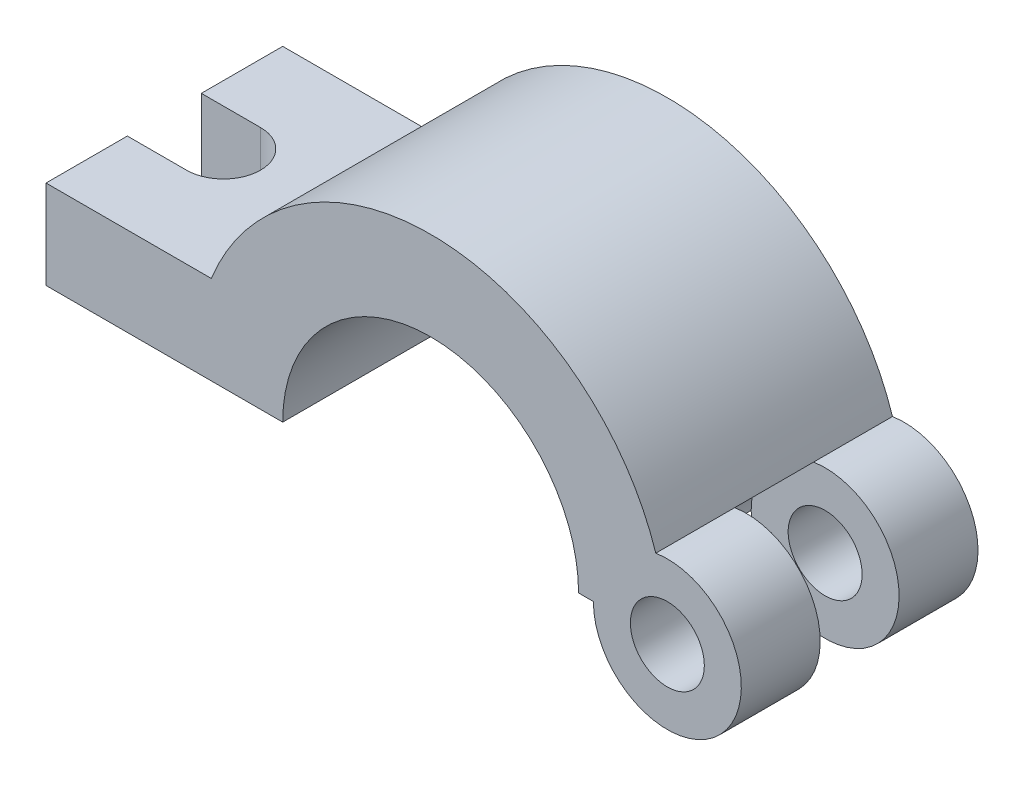
from build123d import *

# Parameters (mm, degrees)
BOSS_EXTRUDE1_DEPTH     = 4
SKETCH2_R               = 2.5
BOSS_EXTRUDE3_DEPTH     = 4
SKETCH3_R               = 1.25
CUT_EXTRUDE1_DEPTH      = 8
SKETCH4_R               = 2.5
CUT_EXTRUDE2_DEPTH      = 1.333333333
CUT_EXTRUDE3_DEPTH      = 15.671400751
CUT_EXTRUDE3_DEPTH_BACK = 3


with BuildPart() as part:
    # Sketch1 → Boss-Extrude1 (new, symmetric)
    with BuildSketch(Plane.XY):
        with BuildLine():
            ThreePointArc((-8, 0), (0, 8), (8, 0))
            Line((8, 0), (5, 0))
            ThreePointArc((5, 0), (0, 5), (-5, 0))
            Line((-5, 0), (-8, 0))
        make_face()
        with BuildLine():
            Line((-13, 0), (-8, 0))
            ThreePointArc((-8, 0), (-7.85269342, 1.5281381), (-7.416198487, 3))
            Line((-7.416198487, 3), (-13, 3))
            Line((-13, 3), (-13, 0))
        make_face()
    extrude(amount=BOSS_EXTRUDE1_DEPTH, both=True)

    # Sketch2 → Boss-Extrude3 (add, symmetric)
    with BuildSketch(Plane.XY):
        with Locations((8, 0)):
            Circle(SKETCH2_R)
    extrude(amount=BOSS_EXTRUDE3_DEPTH, both=True)

    # Sketch3 → Cut-Extrude1 (cut)
    with BuildSketch(Plane.XY.offset(4)):
        with Locations((8, 0)):
            Circle(SKETCH3_R)
    extrude(amount=-CUT_EXTRUDE1_DEPTH, mode=Mode.SUBTRACT)

    # Sketch4 → Cut-Extrude2 (cut, symmetric)
    with BuildSketch(Plane.XY):
        with Locations((8, 0)):
            Circle(SKETCH4_R)
    extrude(amount=CUT_EXTRUDE2_DEPTH, both=True, mode=Mode.SUBTRACT)

    # Sketch5 → Cut-Extrude3 (cut, two sides: drawn at the far end of the back side and taken through both)
    with BuildSketch(Plane(origin=(0, 3, 0), x_dir=(1, 0, 0), z_dir=(0, 1, 0)).offset(-CUT_EXTRUDE3_DEPTH_BACK)):
        with BuildLine():
            Line((-11, 1.25), (-13, 1.25))
            Line((-13, 1.25), (-13, -1.25))
            Line((-13, -1.25), (-11, -1.25))
            ThreePointArc((-11, -1.25), (-9.75, 0), (-11, 1.25))
        make_face()
    extrude(amount=CUT_EXTRUDE3_DEPTH + CUT_EXTRUDE3_DEPTH_BACK, mode=Mode.SUBTRACT)


solid = part.part
